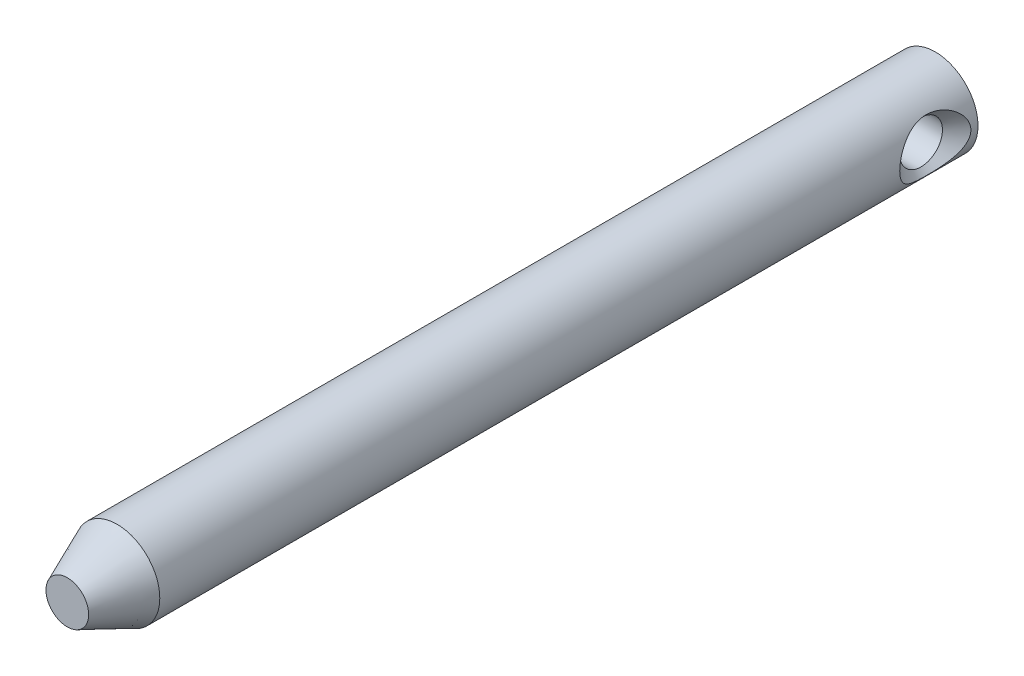
from build123d import *

# Parameters (mm, degrees)
BOSS_EXTRU_1_START = -3
ESQUISSE1_R        = 3
BOSS_EXTRU_1_DEPTH = 61
CHANFREIN1_SIZE    = 3.5
CHANFREIN1_SIZE2   = 1.5


with BuildPart() as part:
    # Esquisse1 → Boss.-Extru.1 (new body)
    with BuildSketch(Plane.XY.offset(BOSS_EXTRU_1_START)):
        with Locations(Location((0, 0, 0), (0, 0, 180))):
            Circle(ESQUISSE1_R)
    extrude(amount=BOSS_EXTRU_1_DEPTH)

    # Chanfrein1
    chanfrein1_edges = [part.edges().sort_by_distance(p)[0] for p in [
        (3, 0, 58),
    ]]
    chanfrein1_side = [part.faces().sort_by_distance(p)[0] for p in [
        (3, 0, 27.5),
    ]]
    chamfer(chanfrein1_edges, length=CHANFREIN1_SIZE, length2=CHANFREIN1_SIZE2, reference=chanfrein1_side[0])

    # Esquisse2 → Enlèvement de matière-Révolution1 (revolve, cut)
    with BuildSketch(Plane(origin=(0, 0, 0), x_dir=(1, 0, 0), z_dir=(0, 1, 0))):
        Polygon((-3, 0), (3, 0), (3, 2.5), (2, 1.5), (-2, 1.5), (-3, 2.5), align=None)
    revolve(axis=Axis((-3, 0, 0), (-1, 0, 0)), mode=Mode.SUBTRACT)


solid = part.part
